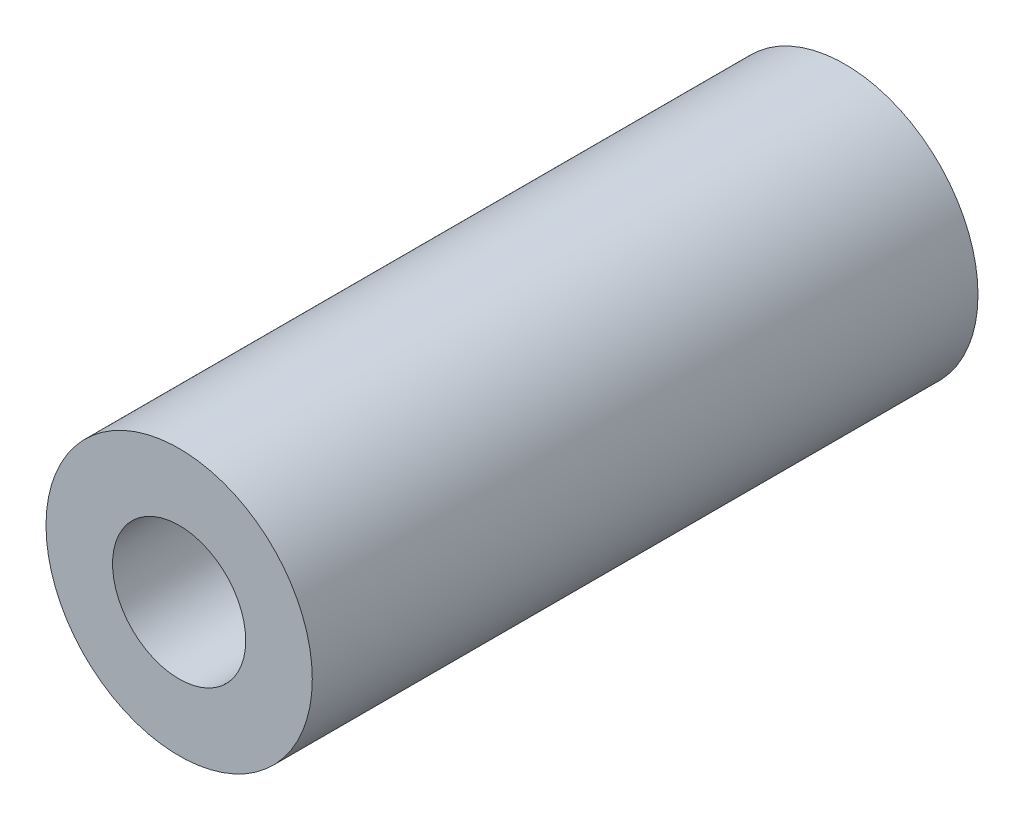
from build123d import *

# Parameters (mm, degrees)
SKETCH1_R           = 2
SKETCH1_R_2         = 1
BOSS_EXTRUDE1_DEPTH = 10


with BuildPart() as part:
    # Sketch1 → Boss-Extrude1 (new body)
    with BuildSketch(Plane.XY):
        Circle(SKETCH1_R)
        Circle(SKETCH1_R_2, mode=Mode.SUBTRACT)
    extrude(amount=BOSS_EXTRUDE1_DEPTH)


solid = part.part
